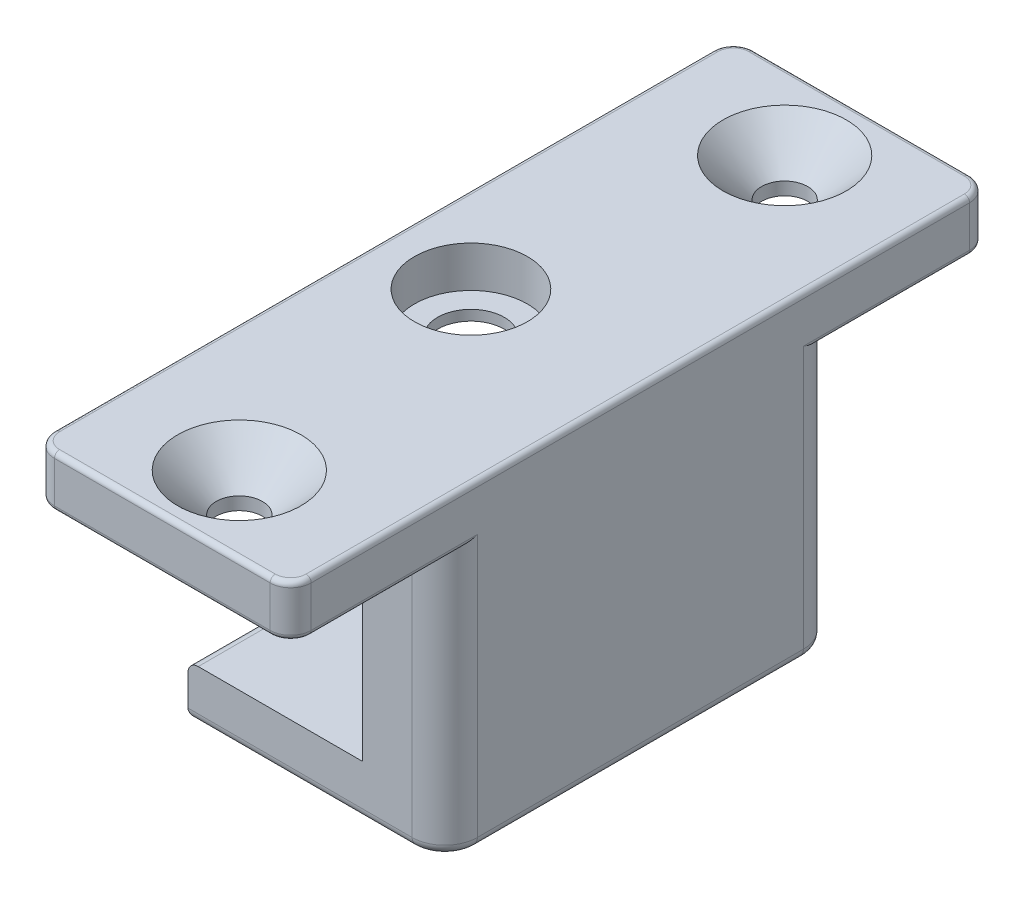
from build123d import *

# Parameters (mm, degrees)
SKETCH1_W           = 25
SKETCH1_H           = 68.1
BOSS_EXTRUDE1_DEPTH = 31.05
CUT_EXTRUDE1_REACH  = 54.426
SKETCH2_W           = 15
SKETCH2_H           = 26.05
SKETCH3_W           = 17
SKETCH3_H           = 21.05
CUT_EXTRUDE2_DEPTH  = 25
FILLET5_R           = 3.175
FILLET2_R           = 1
FILLET6_R           = 2
FILLET3_R           = 0.5


with BuildPart() as part:
    # Sketch1 → Boss-Extrude1 (new body)
    with BuildSketch(Plane(origin=(0, 0, 0), x_dir=(1, 0, 0), z_dir=(0, 1, 0))):
        Rectangle(SKETCH1_W, SKETCH1_H)
    extrude(amount=-BOSS_EXTRUDE1_DEPTH)

    # Sketch2 → Cut-Extrude1 (cut, up to next)
    with BuildSketch(Plane(origin=(12.5, 0, 0), x_dir=(0, 0, -1), z_dir=(1, 0, 0)), mode=Mode.PRIVATE) as cut_extrude1_sk1:
        with Locations((-26.55, -18.025)):
            Rectangle(SKETCH2_W, SKETCH2_H)
    cut_extrude1_tool1 = extrude(cut_extrude1_sk1.sketch, amount=-CUT_EXTRUDE1_REACH, mode=Mode.PRIVATE) & part.part
    # Sketch2 → Cut-Extrude1 (cut, up to next)
    with BuildSketch(Plane(origin=(12.5, 0, 0), x_dir=(0, 0, -1), z_dir=(1, 0, 0)), mode=Mode.PRIVATE) as cut_extrude1_sk2:
        with Locations((26.55, -18.025)):
            Rectangle(SKETCH2_W, SKETCH2_H)
    cut_extrude1_tool2 = extrude(cut_extrude1_sk2.sketch, amount=-CUT_EXTRUDE1_REACH, mode=Mode.PRIVATE) & part.part
    add(cut_extrude1_tool1.solids().sort_by_distance((12.5, -18.025, 26.55))[0], mode=Mode.SUBTRACT)
    add(cut_extrude1_tool2.solids().sort_by_distance((12.5, -18.025, -26.55))[0], mode=Mode.SUBTRACT)

    # Sketch3 → Cut-Extrude2 (cut, symmetric)
    with BuildSketch(Plane.XY):
        with Locations((-4, -15.525)):
            Rectangle(SKETCH3_W, SKETCH3_H)
    extrude(amount=CUT_EXTRUDE2_DEPTH, both=True, mode=Mode.SUBTRACT)

    # Sketch5 → Cut-Revolve1 (revolve, cut)
    with BuildSketch(Plane(origin=(0, 0, 0), x_dir=(0, 0, -1), z_dir=(1, 0, 0)), mode=Mode.PRIVATE) as cut_revolve1_sk:
        Polygon((-32.55, 0), (-28.8, -3.75), (-28.8, -5), (-26.55, -5), (-26.55, 0), align=None)
    cut_revolve1 = revolve(cut_revolve1_sk.sketch.rotate(Axis((0, -5, 26.55), (0, 1, 0)), 180), axis=Axis((0, -5, 26.55), (0, 1, 0)), mode=Mode.SUBTRACT)

    # Mirror1: Cut-Revolve1 across plane
    add(cut_revolve1.mirror(Plane.XY), mode=Mode.SUBTRACT)

    # Sketch6 → Cut-Revolve2 (revolve, cut)
    with BuildSketch(Plane.XY, mode=Mode.PRIVATE) as cut_revolve2_sk:
        Polygon((-4, 0), (-4, -5), (-0.75, -5), (-0.75, -4), (1.5, -4), (1.5, 0), align=None)
    revolve(cut_revolve2_sk.sketch.rotate(Axis((-4, 0, 0), (0, -1, 0)), 180), axis=Axis((-4, 0, 0), (0, -1, 0)), mode=Mode.SUBTRACT)

    # Fillet5
    fillet5_edges = [part.edges().sort_by_distance(p)[0] for p in [
        (12.5, -18.025, 19.05),
        (12.5, -18.025, -19.05),
    ]]
    fillet(fillet5_edges, radius=FILLET5_R)

    # Fillet2
    fillet2_edges = [part.edges().sort_by_distance(p)[0] for p in [
        (-12.5, -31.05, 0),
        (-1.5875, -31.05, 19.05),
        (-1.5875, -31.05, -19.05),
        (-12.5, -26.05, 0),
        (12.5, -31.05, 0),
        (11.57006403, -31.05, -18.12006403),
        (11.57006403, -31.05, 18.12006403),
    ]]
    fillet(fillet2_edges, radius=FILLET2_R)

    # Fillet6
    fillet6_edges = [part.edges().sort_by_distance(p)[0] for p in [
        (12.5, -2.5, -34.05),
        (-12.5, -2.5, -34.05),
        (-12.5, -2.5, 34.05),
        (12.5, -2.5, 34.05),
    ]]
    fillet(fillet6_edges, radius=FILLET6_R)

    # Fillet3
    fillet3_edges = [part.edges().sort_by_distance(p)[0] for p in [
        (0, -5, 34.05),
        (0, 0, 34.05),
        (12.5, 0, 0),
        (0, 0, -34.05),
        (-12.5, 0, 0),
        (-11.914213562, 0, -33.464213562),
        (11.914213562, 0, -33.464213562),
        (-11.914213562, 0, 33.464213562),
        (11.914213562, 0, 33.464213562),
        (12.5, -5, -23.9625),
        (-12.5, -5, 0),
        (0, -5, -34.05),
        (-11.914213562, -5, -33.464213562),
        (11.914213562, -5, -33.464213562),
        (-11.914213562, -5, 33.464213562),
        (11.914213562, -5, 33.464213562),
        (12.5, -5, 23.9625),
    ]]
    fillet(fillet3_edges, radius=FILLET3_R)


solid = part.part
